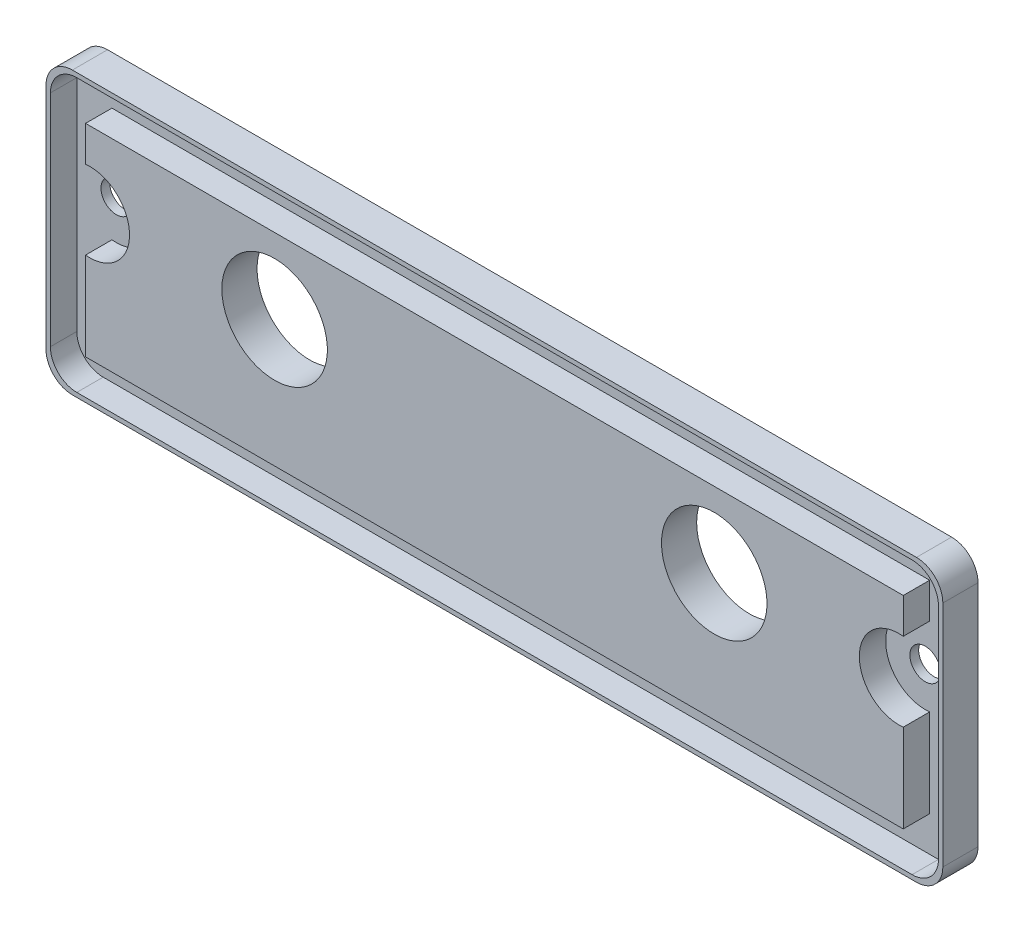
from build123d import *

# Parameters (mm, degrees)
SKETCH1_W           = 102
SKETCH1_H           = 32
BOSS_EXTRUDE1_DEPTH = 1
SKETCH2_W           = 102
SKETCH2_H           = 32
SKETCH2_W_2         = 101
SKETCH2_H_2         = 31
BOSS_EXTRUDE2_DEPTH = 3
SKETCH3_R           = 1.75
CUT_EXTRUDE1_DEPTH  = 107.943910533
FILLET1_R           = 3
SKETCH4_R           = 6
CUT_EXTRUDE2_DEPTH  = 107.976632963


with BuildPart() as part:
    # Sketch1 → Boss-Extrude1 (new body)
    with BuildSketch(Plane.XY):
        with Locations((-51, 16)):
            Rectangle(SKETCH1_W, SKETCH1_H)
    extrude(amount=BOSS_EXTRUDE1_DEPTH)

    # Sketch2 → Boss-Extrude2 (add)
    # profile 1 of 2: a face of its own
    with BuildSketch(Plane.XY.offset(1)):
        with Locations((-51, 16)):
            Rectangle(SKETCH2_W, SKETCH2_H)
        with Locations((-51, 16)):
            Rectangle(SKETCH2_W_2, SKETCH2_H_2, mode=Mode.SUBTRACT)
    # profile 2 of 2: a face of its own
    with BuildSketch(Plane.XY.offset(1)):
        with BuildLine():
            Line((-97.5, 14.527864045), (-97.5, 4.5))
            Line((-97.5, 4.5), (-4.5, 4.5))
            Line((-4.5, 4.5), (-4.5, 14.527864045))
            ThreePointArc((-4.5, 14.527864045), (-9.5, 19), (-4.5, 23.472135955))
            Line((-4.5, 23.472135955), (-4.5, 27.5))
            Line((-4.5, 27.5), (-97.5, 27.5))
            Line((-97.5, 27.5), (-97.5, 23.472135955))
            ThreePointArc((-97.5, 23.472135955), (-92.5, 19), (-97.5, 14.527864045))
        make_face()
    extrude(amount=BOSS_EXTRUDE2_DEPTH)

    # Sketch3 → Cut-Extrude1 (cut, through all)
    with BuildSketch(Plane.XY.offset(1)):
        with Locations((-97, 19)):
            Circle(SKETCH3_R)
        with Locations((-5, 19)):
            Circle(SKETCH3_R)
    extrude(amount=-CUT_EXTRUDE1_DEPTH, mode=Mode.SUBTRACT)

    # Fillet1
    fillet1_edges = [part.edges().sort_by_distance(p)[0] for p in [
        (-101.5, 31.5, 2.5),
        (-0.5, 31.5, 2.5),
        (-0.5, 0.5, 2.5),
        (-101.5, 0.5, 2.5),
        (0, 0, 2),
        (-102, 0, 2),
        (-102, 32, 2),
        (0, 32, 2),
    ]]
    fillet(fillet1_edges, radius=FILLET1_R)

    # Sketch4 → Cut-Extrude2 (cut, through all)
    with BuildSketch(Plane(origin=(0, 0, 0), x_dir=(-1, 0, 0), z_dir=(0, 0, -1))):
        with Locations((26, 18.94)):
            Circle(SKETCH4_R)
        with Locations((76, 18.94)):
            Circle(SKETCH4_R)
    extrude(amount=-CUT_EXTRUDE2_DEPTH, mode=Mode.SUBTRACT)


solid = part.part
